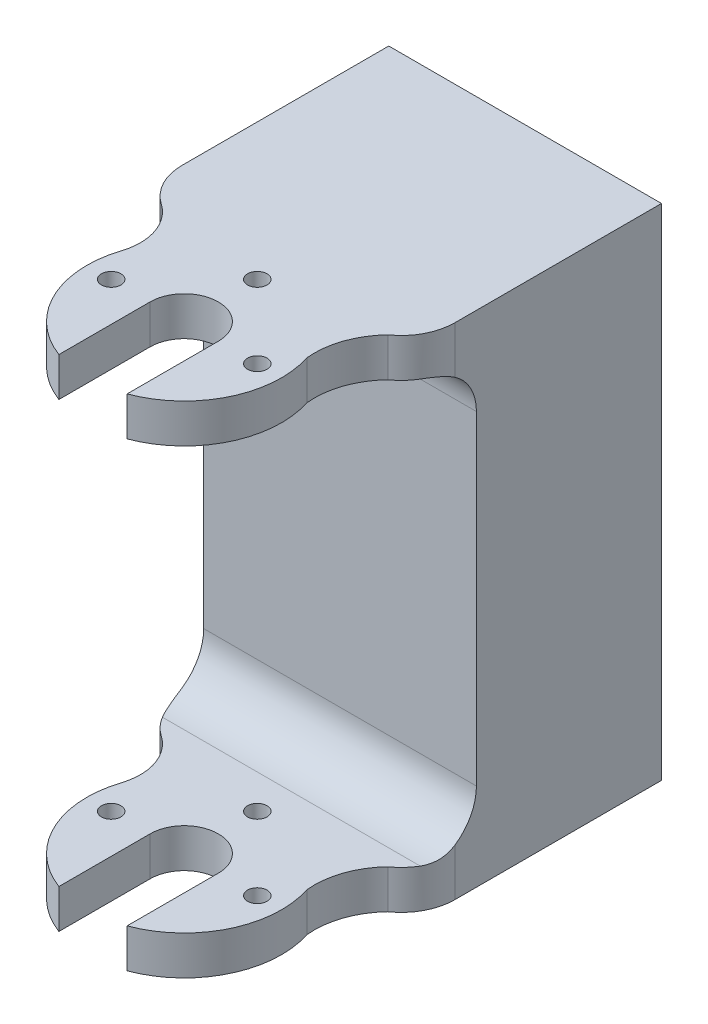
from build123d import *

# Parameters (mm, degrees)
ESQUISSE3_R                  = 3.5
BOSS_EXTRU_1_DEPTH           = 25.65
ENL_V_MAT_EXTRU_2_DEPTH      = 58.051928101
ENL_V_MAT_EXTRU_2_DEPTH_BACK = 58.051928101
ESQUISSE5_W                  = 30
ESQUISSE5_H                  = 43.3
ENL_V_MAT_EXTRU_6_DEPTH      = 73.309681233
ESQUISSE20_W                 = 7
ESQUISSE20_H                 = 11.521668881
ENL_V_MAT_EXTRU_12_DEPTH     = 70.661251783
ESQUISSE22_R                 = 1
ENL_V_MAT_EXTRU_14_DEPTH     = 70.254348527
CONG_2_R                     = 5
ESQUISSE23_W                 = 24
ESQUISSE23_H                 = 36
ENL_V_MAT_EXTRU_15_DEPTH     = 15
CONG_3_R                     = 2


with BuildPart() as part:
    # Esquisse3 → Boss.-Extru.1 (new, symmetric)
    with BuildSketch(Plane(origin=(0, 0, 0), x_dir=(1, 0, 0), z_dir=(0, 1, 0))):
        with BuildLine():
            Line((-14, 0), (-14, -35))
            ThreePointArc((-14, -35), (0, -49), (14, -35))
            Line((14, -35), (14, 0))
            Line((14, 0), (-14, 0))
        make_face()
        with Locations(Location((0, -35, 0), (0, 0, 270))):
            Circle(ESQUISSE3_R, mode=Mode.SUBTRACT)
    extrude(amount=BOSS_EXTRU_1_DEPTH, both=True)

    # Esquisse5 → Enlèv. mat.-Extru.2 (cut, two sides: drawn at the far end of the back side and taken through both)
    with BuildSketch(Plane(origin=(0, 0, 0), x_dir=(0, 0, -1), z_dir=(1, 0, 0)).offset(-ENL_V_MAT_EXTRU_2_DEPTH_BACK)):
        with Locations((-34, 0)):
            Rectangle(ESQUISSE5_W, ESQUISSE5_H)
    extrude(amount=ENL_V_MAT_EXTRU_2_DEPTH + ENL_V_MAT_EXTRU_2_DEPTH_BACK, mode=Mode.SUBTRACT)

    # Esquisse11 → Enlèv. mat.-Extru.6 (cut, through all)
    with BuildSketch(Plane.XZ.offset(25.65)):
        with BuildLine():
            Line((14, 21.20346537), (14, 35))
            ThreePointArc((14, 35), (0, 49), (-14, 35))
            Line((-14, 35), (-14, 21.20346537))
            ThreePointArc((-14, 21.20346537), (-13.370879839, 23.757781245), (-11.627443785, 25.727743806))
            ThreePointArc((-11.627443785, 25.727743806), (-9.546893091, 28.483748084), (-9.519282304, 31.936788544))
            ThreePointArc((-9.519282304, 31.936788544), (0, 45), (9.519282304, 31.936788544))
            ThreePointArc((9.519282304, 31.936788544), (9.893665279, 28.601487898), (11.627443785, 25.727743806))
            ThreePointArc((11.627443785, 25.727743806), (13.370879839, 23.757781245), (14, 21.20346537))
        make_face()
    extrude(amount=-ENL_V_MAT_EXTRU_6_DEPTH, mode=Mode.SUBTRACT)

    # Esquisse20 → Enlèv. mat.-Extru.12 (cut, through all)
    with BuildSketch(Plane.XZ.offset(25.65)):
        with Locations((0, 40.760834441)):
            Rectangle(ESQUISSE20_W, ESQUISSE20_H)
    extrude(amount=-ENL_V_MAT_EXTRU_12_DEPTH, mode=Mode.SUBTRACT)

    # Esquisse22 → Enlèv. mat.-Extru.14 (cut, through all)
    with BuildSketch(Plane.XZ.offset(25.65)):
        with Locations(Location((0, 27.5, 0), (0, 0, 270))):
            Circle(ESQUISSE22_R)
        with Locations(Location((-7.5, 35, 0), (0, 0, 270))):
            Circle(ESQUISSE22_R)
        with Locations((0, 42.5)):
            Circle(ESQUISSE22_R)
        with Locations(Location((7.5, 35, 0), (0, 0, 270))):
            Circle(ESQUISSE22_R)
    extrude(amount=-ENL_V_MAT_EXTRU_14_DEPTH, mode=Mode.SUBTRACT)

    # Congé2
    cong_2_edges = [part.edges().sort_by_distance(p)[0] for p in [
        (0, -21.65, 19),
        (0, 21.65, 19),
    ]]
    fillet(cong_2_edges, radius=CONG_2_R)

    # Esquisse23 → Enlèv. mat.-Extru.15 (cut)
    with BuildSketch(Plane(origin=(0, 0, 0), x_dir=(-1, 0, 0), z_dir=(0, 0, -1))):
        Rectangle(ESQUISSE23_W, ESQUISSE23_H)
    extrude(amount=-ENL_V_MAT_EXTRU_15_DEPTH, mode=Mode.SUBTRACT)

    # Congé3
    cong_3_edges = [part.edges().sort_by_distance(p)[0] for p in [
        (-12, 0, 15),
        (-12, 18, 7.5),
        (0, -18, 15),
        (-12, -18, 7.5),
        (12, 0, 15),
        (12, -18, 7.5),
        (0, 18, 15),
        (12, 18, 7.5),
    ]]
    fillet(cong_3_edges, radius=CONG_3_R)


solid = part.part
